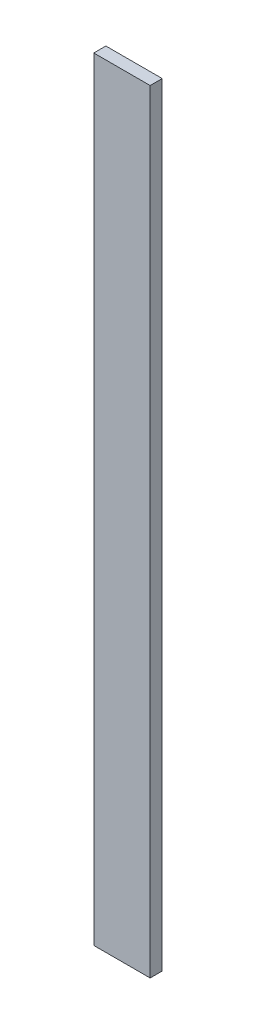
from build123d import *

# Parameters (mm, degrees)
SKETCH1_W           = 88.9
SKETCH1_H           = 19.05
BOSS_EXTRUDE1_DEPTH = 1219.2


with BuildPart() as part:
    # Sketch1 → Boss-Extrude1 (new body)
    with BuildSketch(Plane(origin=(0, 0, 0), x_dir=(1, 0, 0), z_dir=(0, 1, 0))):
        Rectangle(SKETCH1_W, SKETCH1_H)
    extrude(amount=BOSS_EXTRUDE1_DEPTH)


solid = part.part
